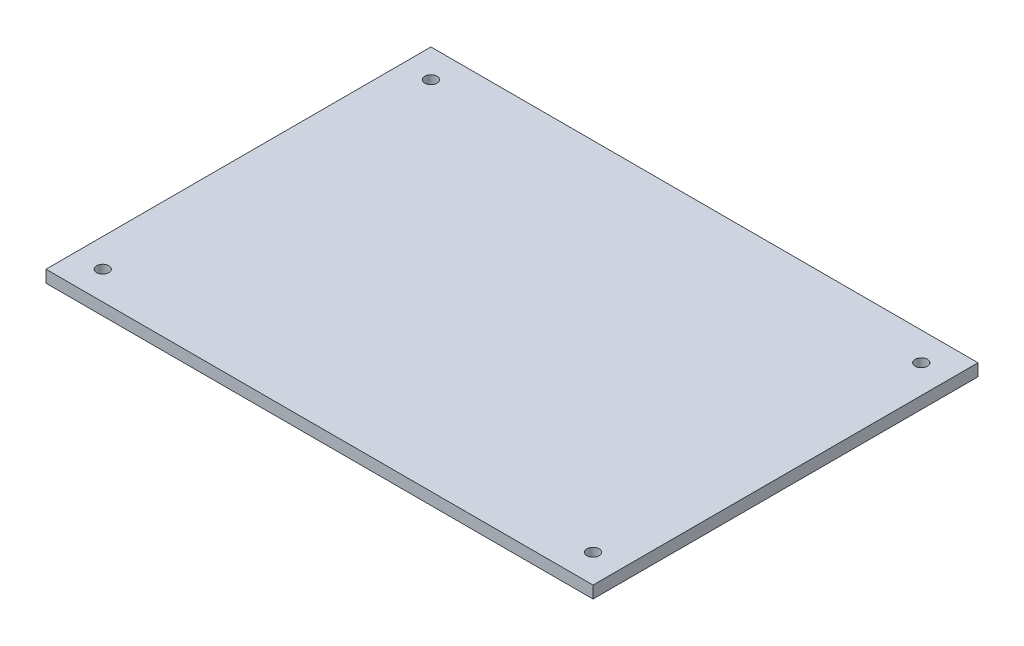
from build123d import *

# Parameters (mm, degrees)
SKETCH1_W                  = 135
SKETCH1_H                  = 95
BOSS_EXTRUDE1_DEPTH        = 3
F_31_0_12_DIAMETER_HOLE1_D = 3.000000096


with BuildPart() as part:
    # Sketch1 → Boss-Extrude1 (new body)
    with BuildSketch(Plane(origin=(0, 0, 0), x_dir=(1, 0, 0), z_dir=(0, 1, 0))):
        Rectangle(SKETCH1_W, SKETCH1_H)
    extrude(amount=BOSS_EXTRUDE1_DEPTH)

    # #31 (0.12) Diameter Hole1 (through all)
    with Locations(Plane(origin=(0, 3, 0), x_dir=(1, 0, 0), z_dir=(0, 1, 0))):
        with Locations((-60.5, 40.5), (-60.5, -40.5), (60.5, 40.5), (60.5, -40.5)):
            Hole(F_31_0_12_DIAMETER_HOLE1_D / 2)


solid = part.part
